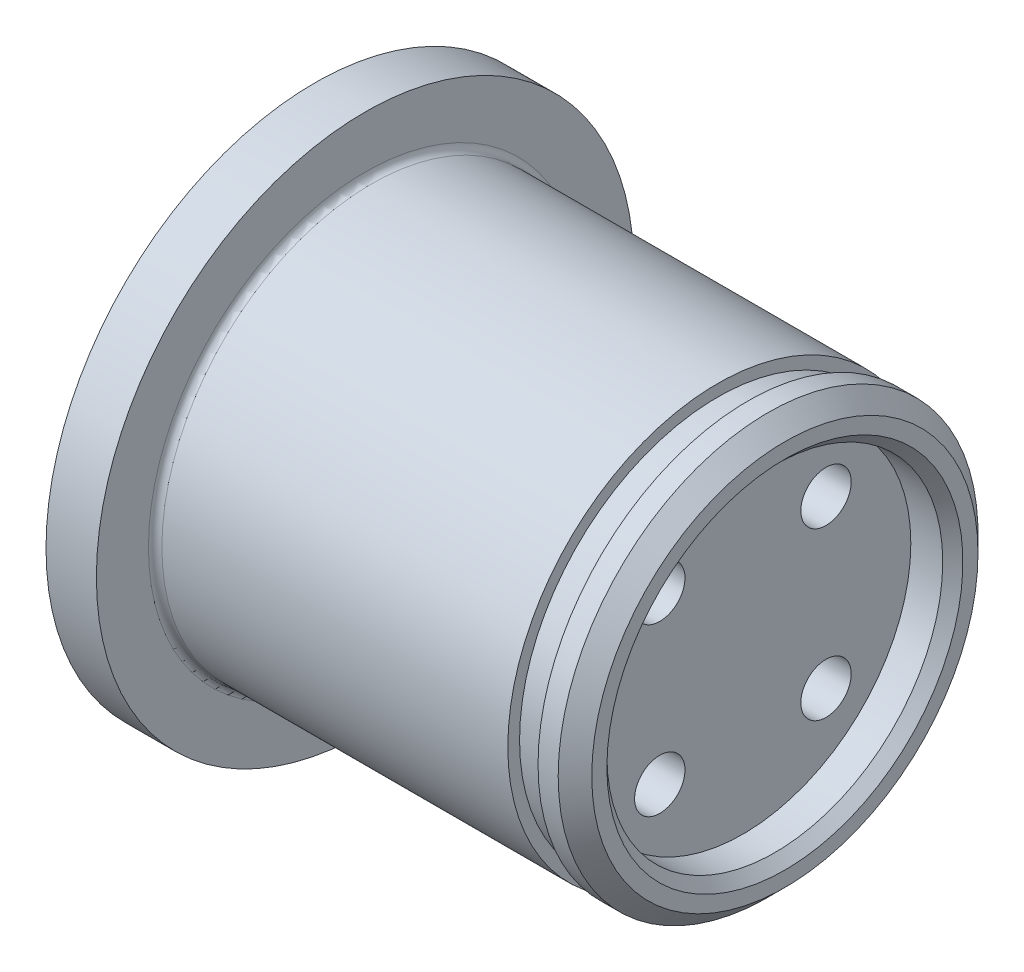
from build123d import *

# Parameters (mm, degrees)
SKETCH_2_W               = 1.8
SKETCH_2_H               = 0.7
CHAMFER_1_SIZE           = 1
FILLET_1_R               = 0.4
HOLE_WIZARD_1_D          = 3
PATTERN_CIRCULAR_1_COUNT = 4
SKETCH_5_W               = 2.5
SKETCH_5_H               = 10
CHAMFER_2_SIZE           = 0.6


with BuildPart() as part:
    # Эскиз1 → Повернуть1 (revolve)
    with BuildSketch(Plane.XY, mode=Mode.PRIVATE) as revolve_1_sk:
        Polygon((0, 0), (0, 12.5), (-25, 12.5), (-25, 16), (-28, 16), (-28, 0), align=None)
    revolve(revolve_1_sk.sketch.rotate(Axis((0, 0, 0), (1, 0, 0)), 90), axis=Axis((0, 0, 0), (1, 0, 0)))

    # Эскиз2 → Вырез-Повернуть1 (revolve, cut)
    with BuildSketch(Plane.XY, mode=Mode.PRIVATE) as cut_revolve_1_sk:
        with Locations((-3.1, 12.15)):
            Rectangle(SKETCH_2_W, SKETCH_2_H)
    revolve(cut_revolve_1_sk.sketch.rotate(Axis((0, 0, 0), (-1, 0, 0)), 270), axis=Axis((0, 0, 0), (-1, 0, 0)), mode=Mode.SUBTRACT)

    # Фаска1
    chamfer_1_edges = [part.edges().sort_by_distance(p)[0] for p in [
        (0, 0, -12.5),
    ]]
    chamfer(chamfer_1_edges, length=CHAMFER_1_SIZE)

    # Скругление1
    fillet_1_edges = [part.edges().sort_by_distance(p)[0] for p in [
        (-25, 0, -12.5),
    ]]
    fillet(fillet_1_edges, radius=FILLET_1_R)

    # Отверстие1 (through all)
    with Locations(Plane(origin=(0, 0, 0), x_dir=(0, 0, -1), z_dir=(1, 0, 0))):
        with Locations((4.949747468, 4.949747468)):
            hole_wizard_1 = Hole(HOLE_WIZARD_1_D / 2)

    # Круговой массив1: Отверстие1 ×4 about axis
    pattern_circular_1_axis = Axis((0, 0, 0), (1, 0, 0))
    for i in range(1, PATTERN_CIRCULAR_1_COUNT):
        add(hole_wizard_1.rotate(pattern_circular_1_axis, i * 360 / PATTERN_CIRCULAR_1_COUNT), mode=Mode.SUBTRACT)

    # Эскиз5 → Вырез-Повернуть2 (revolve, cut)
    with BuildSketch(Plane.XY, mode=Mode.PRIVATE) as cut_revolve_2_sk:
        with Locations((-1.25, 5)):
            Rectangle(SKETCH_5_W, SKETCH_5_H)
    revolve(cut_revolve_2_sk.sketch.rotate(Axis((0, 0, 0), (-1, 0, 0)), 90), axis=Axis((0, 0, 0), (-1, 0, 0)), mode=Mode.SUBTRACT)

    # Фаска2
    chamfer_2_edges = [part.edges().sort_by_distance(p)[0] for p in [
        (0, 0, 10),
    ]]
    chamfer(chamfer_2_edges, length=CHAMFER_2_SIZE)


solid = part.part
